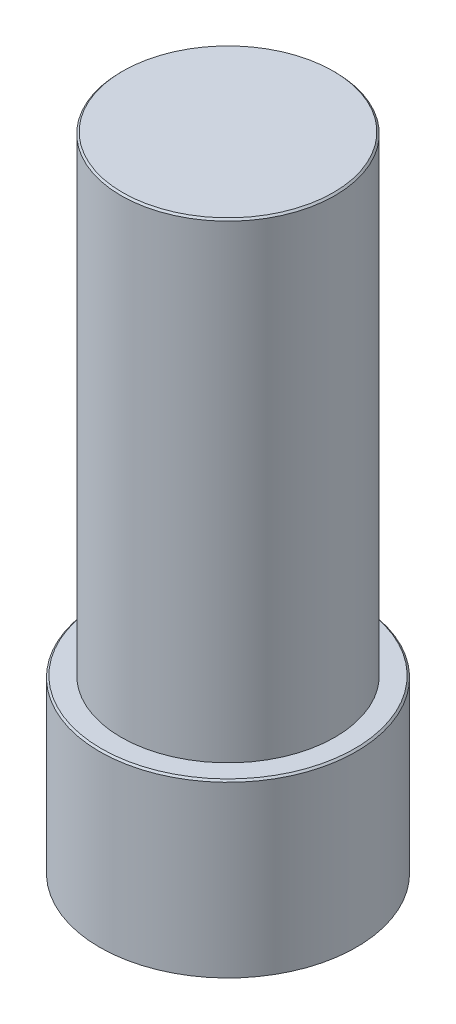
from build123d import *

# Parameters (mm, degrees)
ESQUISSE1_R             = 15
BOSS_EXTRU_1_DEPTH      = 75
ENL_V_START             = -55
ESQUISSE2_R             = 15
ESQUISSE2_R_2           = 12.5
ENL_V_MAT_EXTRU_1_DEPTH = 55
CHANFREIN4_SIZE         = 0.2
CHANFREIN5_SIZE         = 0.2
ENL_V_MAT_EXTRU_2_DEPTH = 3


with BuildPart() as part:
    # Esquisse1 → Boss.-Extru.1 (new body)
    with BuildSketch(Plane(origin=(0, 0, 0), x_dir=(1, 0, 0), z_dir=(0, 1, 0))):
        with Locations(Location((0, 0, 0), (0, 0, 270))):
            Circle(ESQUISSE1_R)
    extrude(amount=BOSS_EXTRU_1_DEPTH)

    # Esquisse2 → Enlèv. mat.-Extru.1 (cut)
    with BuildSketch(Plane(origin=(0, 75, 0), x_dir=(1, 0, 0), z_dir=(0, 1, 0)).offset(ENL_V_START)):
        with Locations(Location((0, 0, 0), (0, 0, 270))):
            Circle(ESQUISSE2_R)
        with Locations(Location((0, 0, 0), (0, 0, 270))):
            Circle(ESQUISSE2_R_2, mode=Mode.SUBTRACT)
    extrude(amount=ENL_V_MAT_EXTRU_1_DEPTH, mode=Mode.SUBTRACT)

    # Chanfrein4
    chanfrein4_edges = [part.edges().sort_by_distance(p)[0] for p in [
        (0, 20, -15),
    ]]
    chamfer(chanfrein4_edges, length=CHANFREIN4_SIZE)

    # Chanfrein5
    chanfrein5_edges = [part.edges().sort_by_distance(p)[0] for p in [
        (0, 75, -12.5),
    ]]
    chamfer(chanfrein5_edges, length=CHANFREIN5_SIZE)

    # Esquisse3 → Enlèv. mat.-Extru.2 (cut)
    with BuildSketch(Plane(origin=(0, 0, -12.5), x_dir=(-1, 0, 0), z_dir=(0, 0, -1))):
        with BuildLine():
            Line((3.25, 70), (3.25, 45))
            ThreePointArc((3.25, 45), (0, 41.75), (-3.25, 45))
            Line((-3.25, 45), (-3.25, 70))
            ThreePointArc((-3.25, 70), (0, 73.25), (3.25, 70))
        make_face()
    extrude(amount=-ENL_V_MAT_EXTRU_2_DEPTH, mode=Mode.SUBTRACT)


solid = part.part
